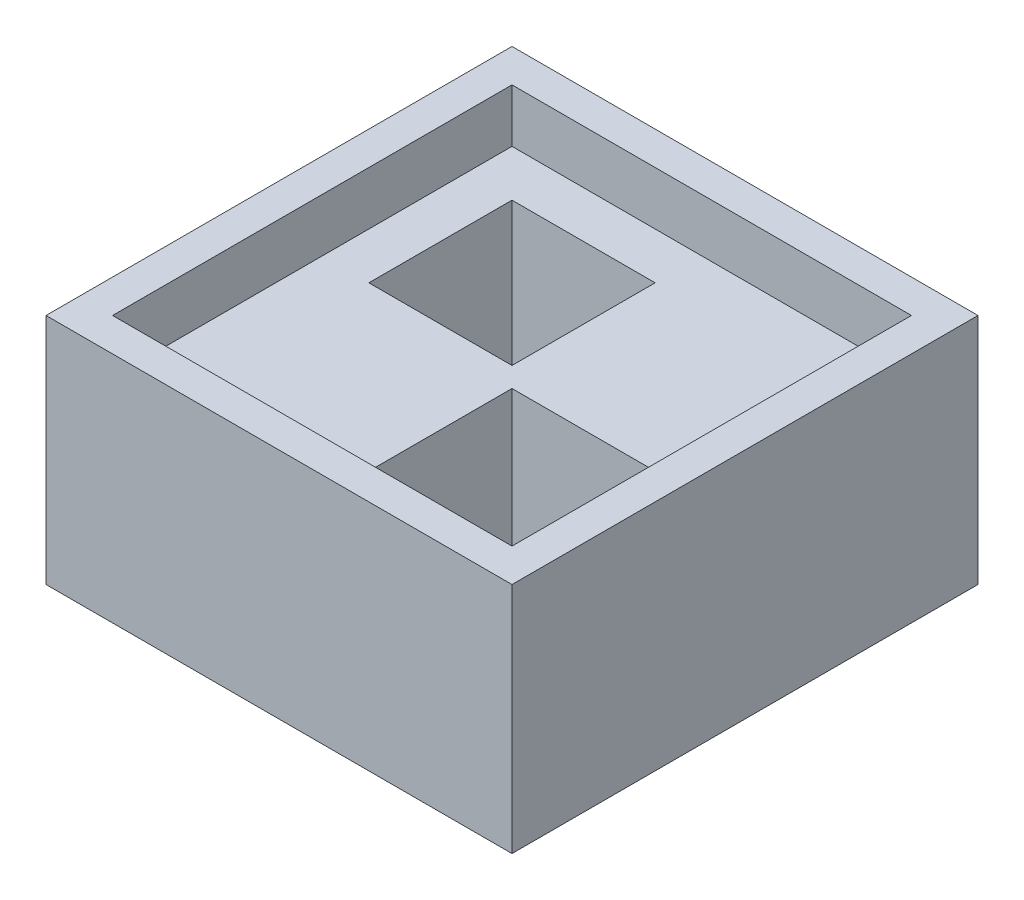
from build123d import *

# Parameters (mm, degrees)
SKETCH1_W           = 70
SKETCH1_H           = 70
BOSS_EXTRUDE1_DEPTH = 35
SKETCH2_W           = 60
SKETCH2_H           = 60
CUT_EXTRUDE1_DEPTH  = 8
SKETCH3_W           = 21.5
SKETCH3_H           = 21.5
CUT_EXTRUDE2_DEPTH  = 25.5


with BuildPart() as part:
    # Sketch1 → Boss-Extrude1 (new body)
    with BuildSketch(Plane(origin=(0, 0, 0), x_dir=(1, 0, 0), z_dir=(0, 1, 0))):
        with Locations((35, 35)):
            Rectangle(SKETCH1_W, SKETCH1_H)
    extrude(amount=BOSS_EXTRUDE1_DEPTH)

    # Sketch2 → Cut-Extrude1 (cut)
    with BuildSketch(Plane(origin=(0, 35, 0), x_dir=(1, 0, 0), z_dir=(0, 1, 0))):
        with Locations((35, 35)):
            Rectangle(SKETCH2_W, SKETCH2_H)
    extrude(amount=-CUT_EXTRUDE1_DEPTH, mode=Mode.SUBTRACT)

    # Sketch3 → Cut-Extrude2 (cut)
    with BuildSketch(Plane(origin=(0, 27, 0), x_dir=(1, 0, 0), z_dir=(0, 1, 0))):
        with Locations((22.75, 47.25)):
            Rectangle(SKETCH3_W, SKETCH3_H)
        with Locations((47.25, 22.75)):
            Rectangle(SKETCH3_W, SKETCH3_H)
    extrude(amount=-CUT_EXTRUDE2_DEPTH, mode=Mode.SUBTRACT)


solid = part.part
